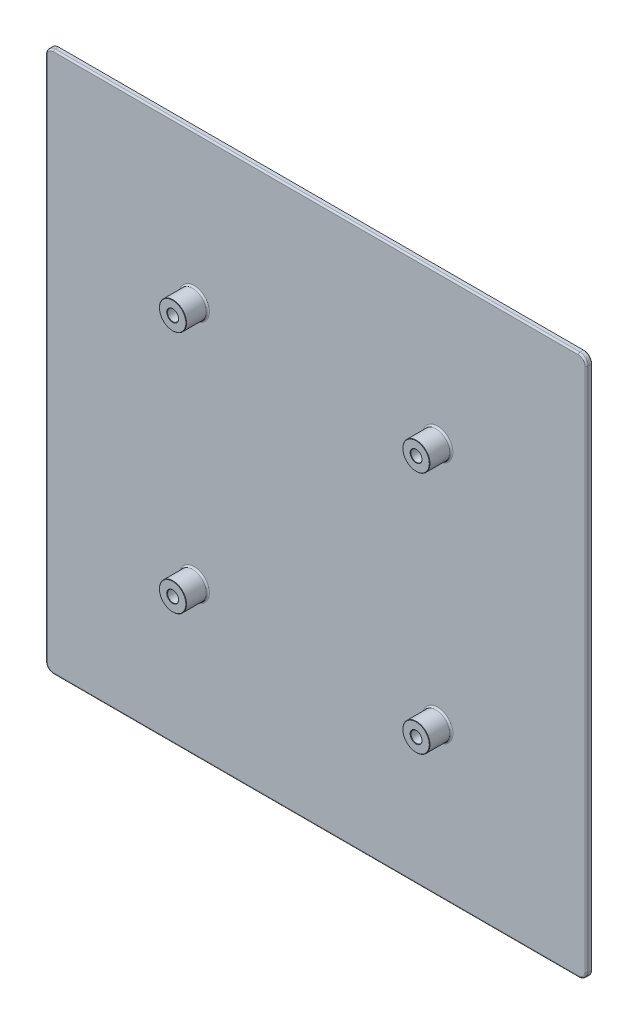
from build123d import *

# Parameters (mm, degrees)
CROQUIS1_W              = 200
CROQUIS1_H              = 200
SALIENTE_EXTRUIR1_DEPTH = 2
CROQUIS1_3_R            = 5
SALIENTE_EXTRUIR2_DEPTH = 8
CORTAR_EXTRUIR1_REACH   = 143.774
CROQUIS2_R              = 2.05
REDONDEO1_R             = 3
CHAFL_N1_SIZE           = 0.14
REDONDEO2_R             = 0.6
CHAFL_N2_SIZE           = 0.14
CHAFL_N3_SIZE           = 0.12


with BuildPart() as part:
    # Croquis1 → Saliente-Extruir1 (new body)
    with BuildSketch(Plane.XY):
        Rectangle(CROQUIS1_W, CROQUIS1_H)
    extrude(amount=-SALIENTE_EXTRUIR1_DEPTH)

    # Croquis1<3> → Saliente-Extruir2 (add)
    with BuildSketch(Plane.XY):
        with Locations((-45, 45)):
            Circle(CROQUIS1_3_R)
        with Locations((-45, -45)):
            Circle(CROQUIS1_3_R)
        with Locations((45, -45)):
            Circle(CROQUIS1_3_R)
        with Locations((45, 45)):
            Circle(CROQUIS1_3_R)
    extrude(amount=SALIENTE_EXTRUIR2_DEPTH)

    # Croquis2 → Cortar-Extruir1 (cut, up to next)
    with BuildSketch(Plane.XY.offset(8), mode=Mode.PRIVATE) as cortar_extruir1_sk1:
        with Locations((-45, 45)):
            Circle(CROQUIS2_R)
    cortar_extruir1_tool1 = extrude(cortar_extruir1_sk1.sketch, amount=-CORTAR_EXTRUIR1_REACH, mode=Mode.PRIVATE) & part.part
    # Croquis2 → Cortar-Extruir1 (cut, up to next)
    with BuildSketch(Plane.XY.offset(8), mode=Mode.PRIVATE) as cortar_extruir1_sk2:
        with Locations((45, 45)):
            Circle(CROQUIS2_R)
    cortar_extruir1_tool2 = extrude(cortar_extruir1_sk2.sketch, amount=-CORTAR_EXTRUIR1_REACH, mode=Mode.PRIVATE) & part.part
    # Croquis2 → Cortar-Extruir1 (cut, up to next)
    with BuildSketch(Plane.XY.offset(8), mode=Mode.PRIVATE) as cortar_extruir1_sk3:
        with Locations((45, -45)):
            Circle(CROQUIS2_R)
    cortar_extruir1_tool3 = extrude(cortar_extruir1_sk3.sketch, amount=-CORTAR_EXTRUIR1_REACH, mode=Mode.PRIVATE) & part.part
    # Croquis2 → Cortar-Extruir1 (cut, up to next)
    with BuildSketch(Plane.XY.offset(8), mode=Mode.PRIVATE) as cortar_extruir1_sk4:
        with Locations((-45, -45)):
            Circle(CROQUIS2_R)
    cortar_extruir1_tool4 = extrude(cortar_extruir1_sk4.sketch, amount=-CORTAR_EXTRUIR1_REACH, mode=Mode.PRIVATE) & part.part
    add(cortar_extruir1_tool1.solids().sort_by_distance((-45, 45, 8))[0], mode=Mode.SUBTRACT)
    add(cortar_extruir1_tool2.solids().sort_by_distance((45, 45, 8))[0], mode=Mode.SUBTRACT)
    add(cortar_extruir1_tool3.solids().sort_by_distance((45, -45, 8))[0], mode=Mode.SUBTRACT)
    add(cortar_extruir1_tool4.solids().sort_by_distance((-45, -45, 8))[0], mode=Mode.SUBTRACT)

    # Redondeo1
    redondeo1_edges = [part.edges().sort_by_distance(p)[0] for p in [
        (-100, 100, -1),
        (-100, -100, -1),
        (100, -100, -1),
        (100, 100, -1),
    ]]
    fillet(redondeo1_edges, radius=REDONDEO1_R)

    # Chaflán1
    chafl_n1_edges = [part.edges().sort_by_distance(p)[0] for p in [
        (100, 0, -2),
        (0, 100, -2),
        (-100, 0, -2),
        (0, -100, -2),
        (-47.05, 45, -2),
        (42.95, 45, -2),
        (42.95, -45, -2),
        (-47.05, -45, -2),
        (-99.121320344, -99.121320344, -2),
        (99.121320344, -99.121320344, -2),
        (99.121320344, 99.121320344, -2),
        (-99.121320344, 99.121320344, -2),
    ]]
    chamfer(chafl_n1_edges, length=CHAFL_N1_SIZE)

    # Redondeo2
    redondeo2_edges = [part.edges().sort_by_distance(p)[0] for p in [
        (99.121320344, 99.121320344, 0),
        (100, 0, 0),
        (99.121320344, -99.121320344, 0),
        (0, -100, 0),
        (-99.121320344, -99.121320344, 0),
        (-100, 0, 0),
        (-99.121320344, 99.121320344, 0),
        (0, 100, 0),
        (-50, 45, 0),
        (40, -45, 0),
        (40, 45, 0),
        (-50, -45, 0),
    ]]
    fillet(redondeo2_edges, radius=REDONDEO2_R)

    # Chaflán2
    chafl_n2_edges = [part.edges().sort_by_distance(p)[0] for p in [
        (42.95, 45, 8),
        (-47.05, 45, 8),
        (-47.05, -45, 8),
        (42.95, -45, 8),
    ]]
    chamfer(chafl_n2_edges, length=CHAFL_N2_SIZE)

    # Chaflán3
    chafl_n3_edges = [part.edges().sort_by_distance(p)[0] for p in [
        (40, 45, 8),
        (-50, 45, 8),
        (-50, -45, 8),
        (40, -45, 8),
    ]]
    chamfer(chafl_n3_edges, length=CHAFL_N3_SIZE)


solid = part.part
